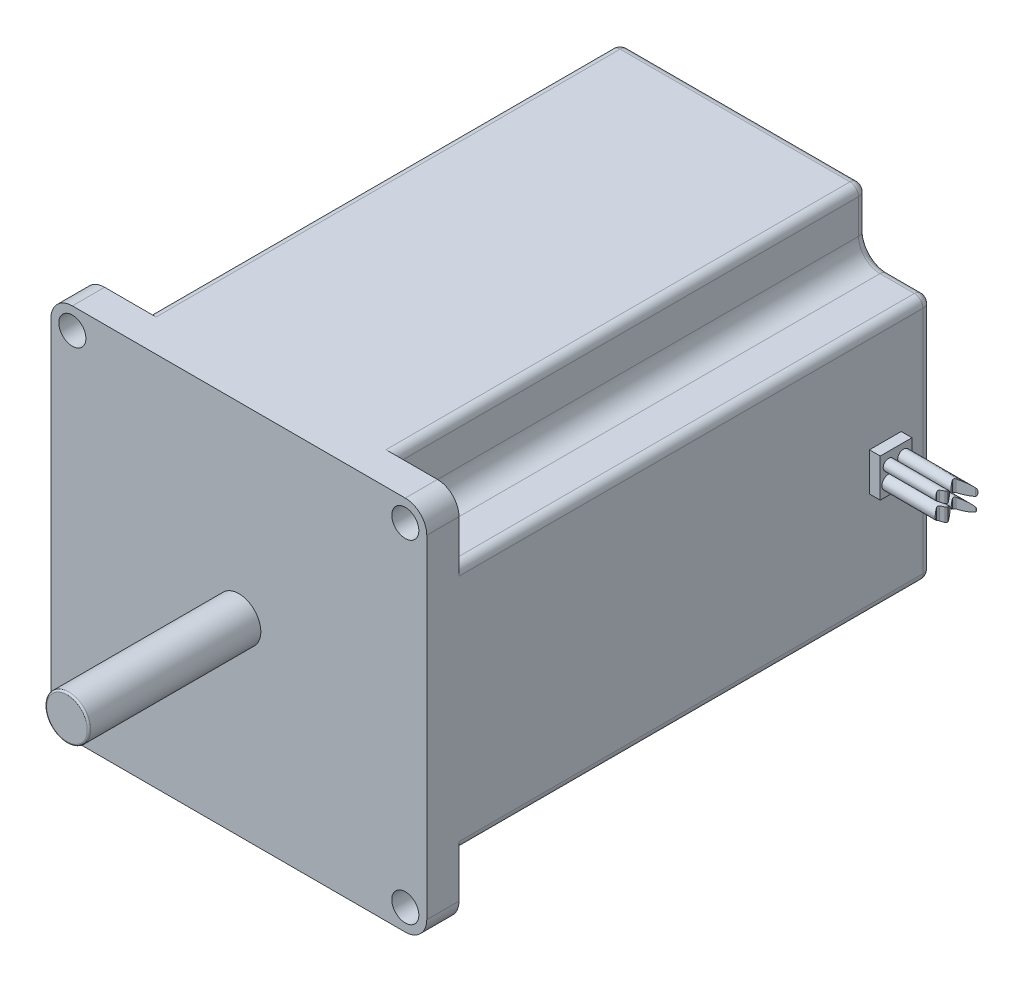
from build123d import *

# Parameters (mm, degrees)
BOSS_EXTRUDE1_DEPTH = 69.85
SKETCH2_R           = 2
BOSS_EXTRUDE2_DEPTH = 4.7625
SKETCH3_R           = 3.25
BOSS_EXTRUDE3_DEPTH = 25.4
FILLET1_R           = 1.27
FILLET2_R           = 0.254
SKETCH4_R           = 0.80002704
SKETCH4_R_2         = 0.877357611
SKETCH4_R_3         = 0.997824801
SKETCH4_R_4         = 0.748045891
BOSS_EXTRUDE4_DEPTH = 12.7
CUT_EXTRUDE1_DEPTH  = 12.7
SKETCH6_W           = 4.683113718
SKETCH6_H           = 5.652977511
BOSS_EXTRUDE5_DEPTH = 1.5875


with BuildPart() as part:
    # Sketch1 → Boss-Extrude1 (new body)
    with BuildSketch(Plane.XY):
        with BuildLine():
            Line((-39.727633427, -26.251720506), (-39.727633427, -31.331720506))
            ThreePointArc((-39.727633427, -31.331720506), (-39.355659039, -32.229746118), (-38.457633427, -32.601720506))
            Line((-38.457633427, -32.601720506), (-4.485133427, -32.601720506))
            ThreePointArc((-4.485133427, -32.601720506), (-3.587107815, -32.229746118), (-3.215133427, -31.331720506))
            Line((-3.215133427, -31.331720506), (-3.215133427, -26.251720506))
            ThreePointArc((-3.215133427, -26.251720506), (-2.285197457, -24.006656475), (-0.040133427, -23.076720506))
            Line((-0.040133427, -23.076720506), (5.039866573, -23.076720506))
            ThreePointArc((5.039866573, -23.076720506), (5.937892185, -22.704746118), (6.309866573, -21.806720506))
            Line((6.309866573, -21.806720506), (6.309866573, 12.165779494))
            ThreePointArc((6.309866573, 12.165779494), (5.937892185, 13.063805106), (5.039866573, 13.435779494))
            Line((5.039866573, 13.435779494), (-0.040133427, 13.435779494))
            ThreePointArc((-0.040133427, 13.435779494), (-2.285197457, 14.365715464), (-3.215133427, 16.610779494))
            Line((-3.215133427, 16.610779494), (-3.215133427, 21.690779494))
            ThreePointArc((-3.215133427, 21.690779494), (-3.587107815, 22.588805106), (-4.485133427, 22.960779494))
            Line((-4.485133427, 22.960779494), (-38.457633427, 22.960779494))
            ThreePointArc((-38.457633427, 22.960779494), (-39.355659039, 22.588805106), (-39.727633427, 21.690779494))
            Line((-39.727633427, 21.690779494), (-39.727633427, 16.610779494))
            ThreePointArc((-39.727633427, 16.610779494), (-40.657569397, 14.365715464), (-42.902633427, 13.435779494))
            Line((-42.902633427, 13.435779494), (-47.982633427, 13.435779494))
            ThreePointArc((-47.982633427, 13.435779494), (-48.880659039, 13.063805106), (-49.252633427, 12.165779494))
            Line((-49.252633427, 12.165779494), (-49.252633427, -21.806720506))
            ThreePointArc((-49.252633427, -21.806720506), (-48.880659039, -22.704746118), (-47.982633427, -23.076720506))
            Line((-47.982633427, -23.076720506), (-42.902633427, -23.076720506))
            ThreePointArc((-42.902633427, -23.076720506), (-40.657569397, -24.006656475), (-39.727633427, -26.251720506))
        make_face()
    extrude(amount=BOSS_EXTRUDE1_DEPTH)

    # Sketch2 → Boss-Extrude2 (add)
    with BuildSketch(Plane.XY.offset(69.85)):
        with BuildLine():
            Line((-46.077633427, 22.960779494), (3.134866573, 22.960779494))
            ThreePointArc((3.134866573, 22.960779494), (5.379930603, 22.030843525), (6.309866573, 19.785779494))
            Line((6.309866573, 19.785779494), (6.309866573, -29.426720506))
            ThreePointArc((6.309866573, -29.426720506), (5.379930603, -31.671784536), (3.134866573, -32.601720506))
            Line((3.134866573, -32.601720506), (-46.077633427, -32.601720506))
            ThreePointArc((-46.077633427, -32.601720506), (-48.322697457, -31.671784536), (-49.252633427, -29.426720506))
            Line((-49.252633427, -29.426720506), (-49.252633427, 19.785779494))
            ThreePointArc((-49.252633427, 19.785779494), (-48.322697457, 22.030843525), (-46.077633427, 22.960779494))
        make_face()
        with Locations(Location((-46.077633427, 19.785779494, 0), (0, 0, 180))):
            Circle(SKETCH2_R, mode=Mode.SUBTRACT)
        with Locations(Location((3.134866573, 19.785779494, 0), (0, 0, 180))):
            Circle(SKETCH2_R, mode=Mode.SUBTRACT)
        with Locations(Location((3.134866573, -29.426720506, 0), (0, 0, 180))):
            Circle(SKETCH2_R, mode=Mode.SUBTRACT)
        with Locations(Location((-46.077633427, -29.426720506, 0), (0, 0, 180))):
            Circle(SKETCH2_R, mode=Mode.SUBTRACT)
    extrude(amount=BOSS_EXTRUDE2_DEPTH)

    # Sketch3 → Boss-Extrude3 (add)
    with BuildSketch(Plane.XY.offset(74.6125)):
        with Locations(Location((-21.471383427, -4.820470506, 0), (0, 0, 180))):
            Circle(SKETCH3_R)
    extrude(amount=BOSS_EXTRUDE3_DEPTH)

    # Fillet1
    fillet1_edges = [part.edges().sort_by_distance(p)[0] for p in [
        (-45.442633427, -23.076720506, 0),
        (-48.880659039, -22.704746118, 0),
        (-49.252633427, -4.820470506, 0),
        (-48.880659039, 13.063805106, 0),
        (-45.442633427, 13.435779494, 0),
        (-40.657569397, 14.365715464, 0),
        (-39.727633427, 19.150779494, 0),
        (-39.355659039, 22.588805106, 0),
        (-21.471383427, 22.960779494, 0),
        (-3.587107815, 22.588805106, 0),
        (-3.215133427, 19.150779494, 0),
        (-2.285197457, 14.365715464, 0),
        (2.499866573, 13.435779494, 0),
        (5.937892185, 13.063805106, 0),
        (6.309866573, -4.820470506, 0),
        (5.937892185, -22.704746118, 0),
        (2.499866573, -23.076720506, 0),
        (-2.285197457, -24.006656475, 0),
        (-3.215133427, -28.791720506, 0),
        (-3.587107815, -32.229746118, 0),
        (-21.471383427, -32.601720506, 0),
        (-39.355659039, -32.229746118, 0),
        (-39.727633427, -28.791720506, 0),
        (-40.657569397, -24.006656475, 0),
    ]]
    fillet(fillet1_edges, radius=FILLET1_R)

    # Fillet2
    fillet2_edges = [part.edges().sort_by_distance(p)[0] for p in [
        (-18.221383427, -4.820470506, 100.0125),
    ]]
    fillet(fillet2_edges, radius=FILLET2_R)

    # Sketch4 → Boss-Extrude4 (add)
    with BuildSketch(Plane(origin=(6.309866573, 0, 0), x_dir=(0, 0, -1), z_dir=(1, 0, 0))):
        with Locations(Location((-7.9375, -3.709220506, 0), (0, 0, 270))):
            Circle(SKETCH4_R)
        with Locations(Location((-5.715, -3.709220506, 0), (0, 0, 270))):
            Circle(SKETCH4_R_2)
        with Locations(Location((-7.9375, -5.931720506, 0), (0, 0, 270))):
            Circle(SKETCH4_R_3)
        with Locations(Location((-5.715, -5.931720506, 0), (0, 0, 270))):
            Circle(SKETCH4_R_4)
    extrude(amount=BOSS_EXTRUDE4_DEPTH)

    # Sketch5 → Cut-Extrude1 (cut)
    with BuildSketch(Plane(origin=(0, 0, 0), x_dir=(1, 0, 0), z_dir=(0, 1, 0))):
        with BuildLine():
            Line((19.40157432, -15.483292253), (15.569046376, -8.549651145))
            ThreePointArc((15.569046376, -8.549651145), (15.552114593, -8.341430664), (15.697013921, -8.190942663))
            Line((15.697013921, -8.190942663), (16.262546188, -7.964729756))
            ThreePointArc((16.262546188, -7.964729756), (16.409544972, -7.808110678), (16.383956807, -7.594842245))
            Line((16.383956807, -7.594842245), (15.425992047, -6.05311771))
            ThreePointArc((15.425992047, -6.05311771), (15.404972946, -5.827088801), (15.573063537, -5.674522674))
            Line((15.573063537, -5.674522674), (17.830264536, -5.040651161))
            ThreePointArc((17.830264536, -5.040651161), (18.003893911, -4.872306809), (17.957864643, -4.634886744))
            Line((17.957864643, -4.634886744), (14.477857706, -0.398356559))
            Line((14.477857706, -0.398356559), (15.904974427, 0.453519903))
            Line((15.904974427, 0.453519903), (25.632541799, -10.775224085))
            Line((25.632541799, -10.775224085), (19.40157432, -15.483292253))
        make_face()
    extrude(amount=-CUT_EXTRUDE1_DEPTH, mode=Mode.SUBTRACT)

    # Sketch6 → Boss-Extrude5 (add)
    with BuildSketch(Plane(origin=(6.309866573, 0, 0), x_dir=(0, 0, -1), z_dir=(1, 0, 0))):
        with Locations((-6.830267964, -4.820470506)):
            Rectangle(SKETCH6_W, SKETCH6_H)
    extrude(amount=BOSS_EXTRUDE5_DEPTH)


solid = part.part
